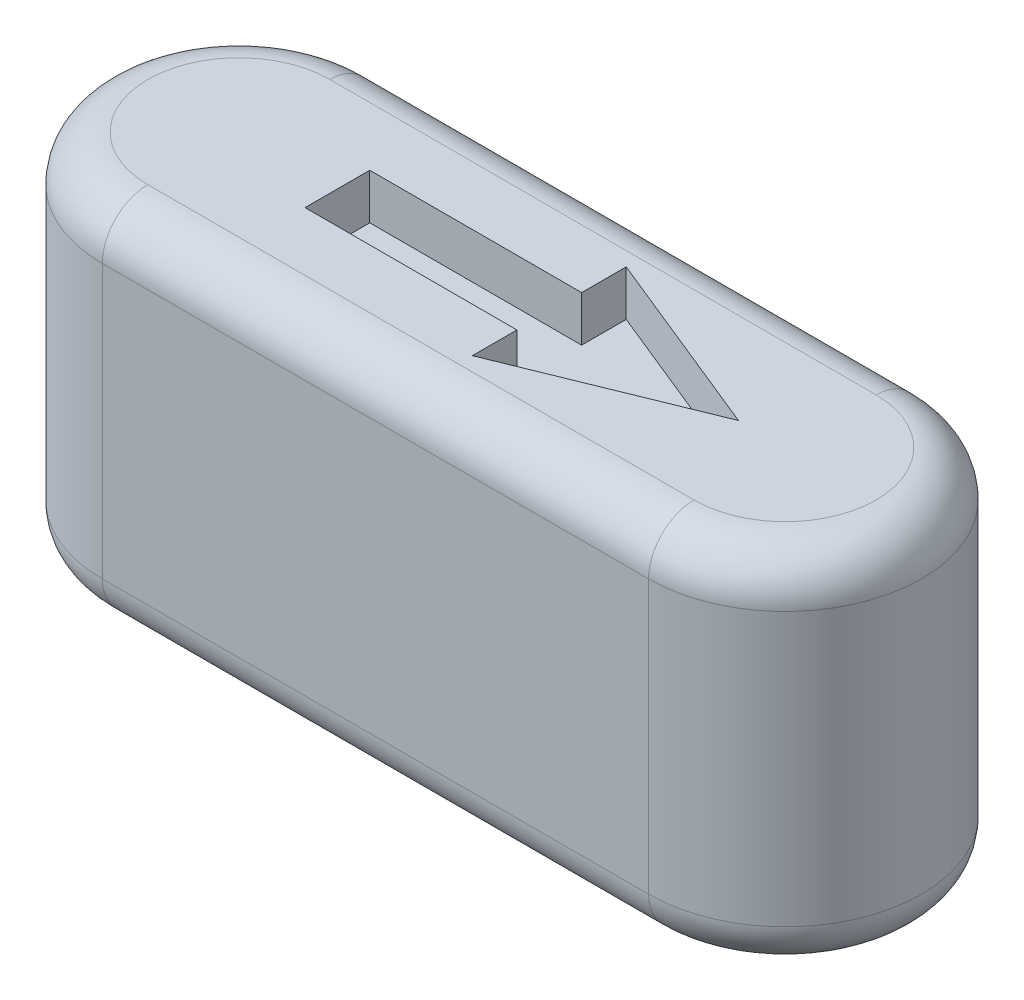
from build123d import *

# Parameters (mm, degrees)
BOSS_EXTRUDE1_DEPTH = 10.16
CUT_EXTRUDE1_DEPTH  = 1.27
FILLET2_R           = 1.27
FILLET3_R           = 1.27


with BuildPart() as part:
    # Sketch1 → Boss-Extrude1 (new body)
    with BuildSketch(Plane(origin=(0, 0, 0), x_dir=(1, 0, 0), z_dir=(0, 1, 0))):
        with BuildLine():
            Line((0, 3.81), (15.24, 3.81))
            ThreePointArc((15.24, 3.81), (19.05, 0), (15.24, -3.81))
            Line((15.24, -3.81), (0, -3.81))
            ThreePointArc((0, -3.81), (-3.81, 0), (0, 3.81))
        make_face()
    extrude(amount=BOSS_EXTRUDE1_DEPTH)

    # Sketch2 → Cut-Extrude1 (cut)
    with BuildSketch(Plane(origin=(0, 10.16, 0), x_dir=(1, 0, 0), z_dir=(0, 1, 0))):
        Polygon((2.748829604, -0.902510302), (2.748829604, 0.902510302), (8.660197845, 0.902510302), (8.660197845, 2.14567358), (13.937299107, 0), (8.660197845, -2.14567358), (8.660197845, -0.902510302), align=None)
    extrude(amount=-CUT_EXTRUDE1_DEPTH, mode=Mode.SUBTRACT)

    # Fillet2
    fillet2_edges = [part.edges().sort_by_distance(p)[0] for p in [
        (19.05, 10.16, 0),
        (7.62, 10.16, -3.81),
        (-3.81, 10.16, 0),
        (7.62, 10.16, 3.81),
    ]]
    fillet(fillet2_edges, radius=FILLET2_R)

    # Fillet3
    fillet3_edges = [part.edges().sort_by_distance(p)[0] for p in [
        (7.62, 0, -3.81),
        (19.05, 0, 0),
        (7.62, 0, 3.81),
        (-3.81, 0, 0),
    ]]
    fillet(fillet3_edges, radius=FILLET3_R)


solid = part.part
